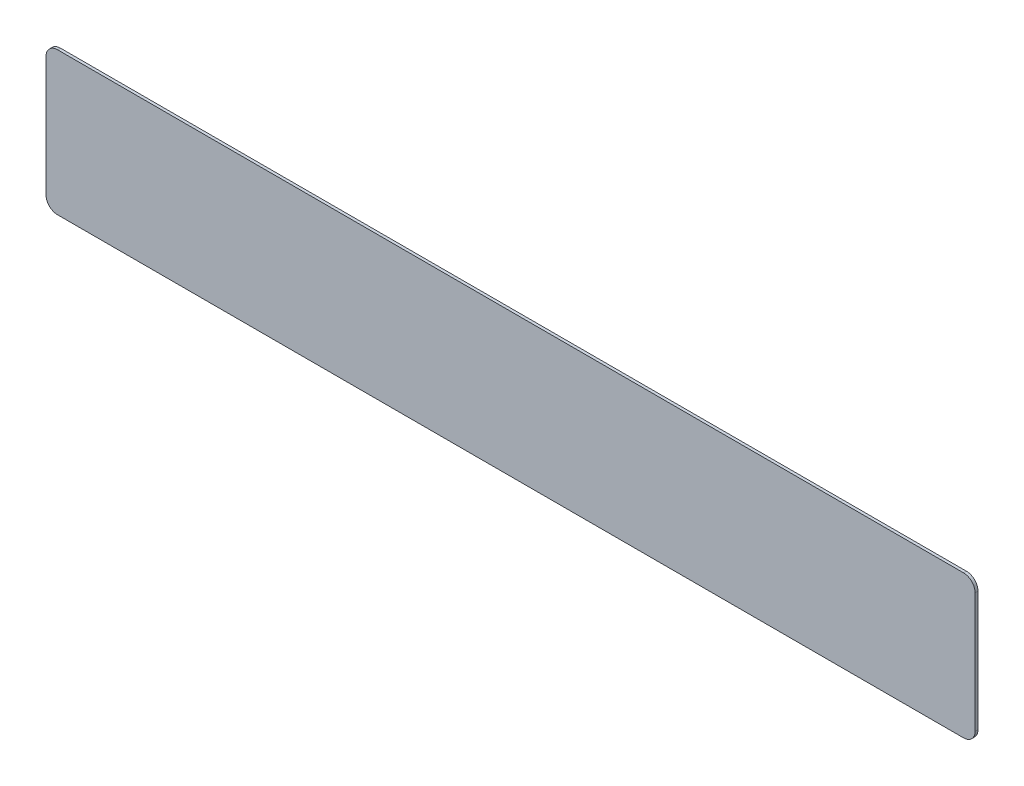
from build123d import *

# Parameters (mm, degrees)
BOSS_EXTRUDE1_DEPTH = 2


with BuildPart() as part:
    # Sketch1 → Boss-Extrude1 (new body)
    with BuildSketch(Plane.XY):
        with BuildLine():
            Line((-316.901308233, -50), (316.901308233, -50))
            ThreePointArc((316.901308233, -50), (322.6279481, -47.6279481), (325, -41.901308233))
            Line((325, -41.901308233), (325, 41.901308233))
            ThreePointArc((325, 41.901308233), (322.6279481, 47.6279481), (316.901308233, 50))
            Line((316.901308233, 50), (-316.901308233, 50))
            ThreePointArc((-316.901308233, 50), (-322.6279481, 47.6279481), (-325, 41.901308233))
            Line((-325, 41.901308233), (-325, -41.901308233))
            ThreePointArc((-325, -41.901308233), (-322.6279481, -47.6279481), (-316.901308233, -50))
        make_face()
    extrude(amount=BOSS_EXTRUDE1_DEPTH)


solid = part.part
